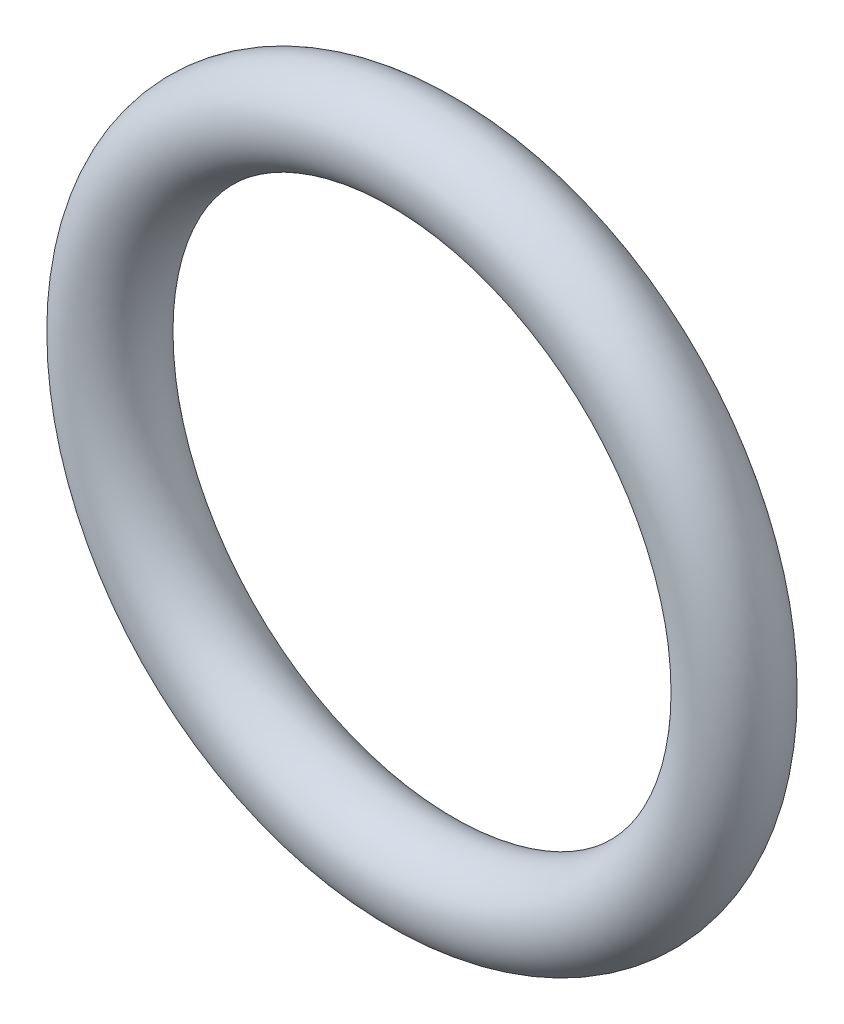
from build123d import *

# Parameters (mm, degrees)
SKETCH_1_R = 1.335


with BuildPart() as part:
    # Эскиз1 → Повернуть1 (revolve)
    with BuildSketch(Plane(origin=(0, 0, 0), x_dir=(0, 0, -1), z_dir=(1, 0, 0))):
        with Locations((0, 9.335)):
            Circle(SKETCH_1_R)
    revolve(axis=Axis((0, 0, 8.410401669), (0, 0, -1)))


solid = part.part
